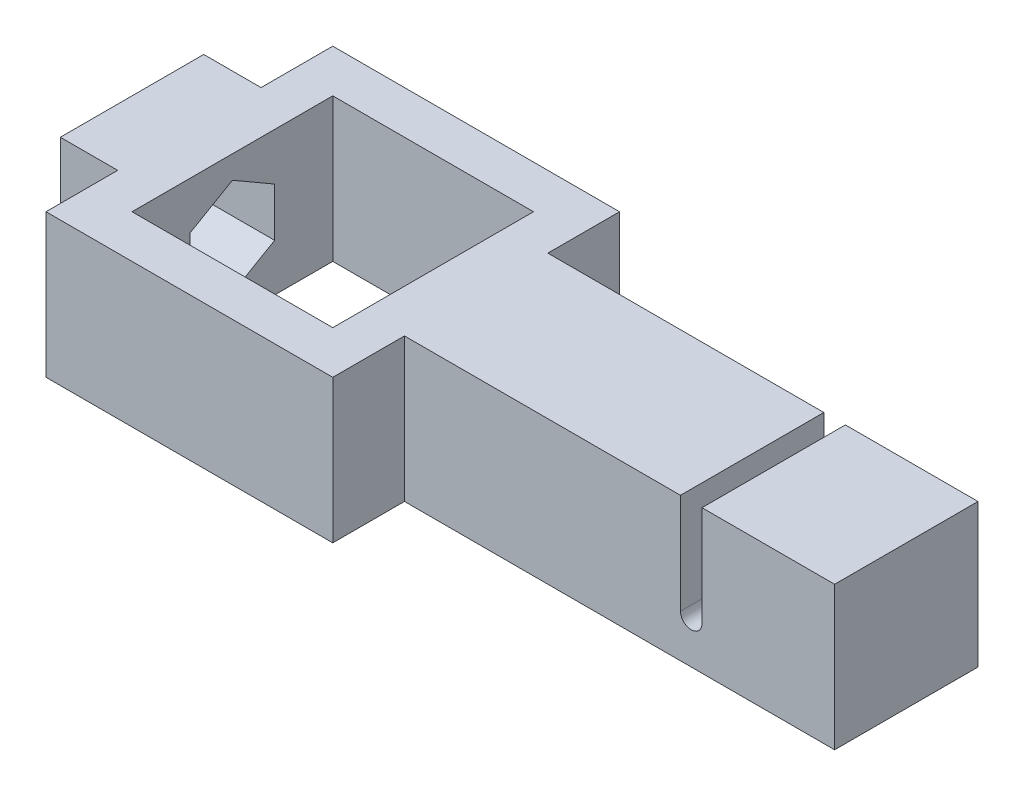
from build123d import *

# Parameters (mm, degrees)
SKETCH1_W           = 14
SKETCH1_H           = 14
BOSS_EXTRUDE1_DEPTH = 10
CUT_EXTRUDE1_REACH  = 37
SKETCH4_R           = 1.85
CUT_EXTRUDE2_DEPTH  = 2
CUT_EXTRUDE3_REACH  = 57.036


with BuildPart() as part:
    # Sketch1 → Boss-Extrude1 (new body)
    with BuildSketch(Plane(origin=(0, 0, 0), x_dir=(1, 0, 0), z_dir=(0, 1, 0))):
        Polygon((0, 0), (30, 0), (30, 10), (0, 10), (0, 15), (-20, 15), (-20, 10), (-24, 10), (-24, 0), (-20, 0), (-20, -5), (0, -5), align=None)
        with Locations((-10, 5)):
            Rectangle(SKETCH1_W, SKETCH1_H, mode=Mode.SUBTRACT)
    extrude(amount=BOSS_EXTRUDE1_DEPTH)

    # Sketch3 → Cut-Extrude1 (cut, up to next)
    with BuildSketch(Plane.XY, mode=Mode.PRIVATE) as cut_extrude1_sk1:
        with BuildLine():
            Line((19.25, 10), (20.75, 10))
            Line((20.75, 10), (20.75, 3))
            ThreePointArc((20.75, 3), (20, 2.25), (19.25, 3))
            Line((19.25, 3), (19.25, 10))
        make_face()
    cut_extrude1_tool1 = extrude(cut_extrude1_sk1.sketch, amount=-CUT_EXTRUDE1_REACH, mode=Mode.PRIVATE) & part.part
    add(cut_extrude1_tool1.solids().sort_by_distance((20, 6.203629, 0))[0], mode=Mode.SUBTRACT)

    # Sketch4 → Cut-Extrude2 (cut)
    with BuildSketch(Plane.ZY.offset(24)):
        with Locations((-5, 5)):
            Circle(SKETCH4_R)
    extrude(amount=-CUT_EXTRUDE2_DEPTH, mode=Mode.SUBTRACT)

    # Sketch5 → Cut-Extrude3 (cut, up to next)
    with BuildSketch(Plane.ZY.offset(22), mode=Mode.PRIVATE) as cut_extrude3_sk1:
        Polygon((-5, 8.4), (-7.944486373, 6.7), (-7.944486373, 3.3), (-5, 1.6), (-2.055513627, 3.3), (-2.055513627, 6.7), align=None)
    cut_extrude3_tool1 = extrude(cut_extrude3_sk1.sketch, amount=-CUT_EXTRUDE3_REACH, mode=Mode.PRIVATE) & part.part
    add(cut_extrude3_tool1.solids().sort_by_distance((-22, 5, -5))[0], mode=Mode.SUBTRACT)


solid = part.part
